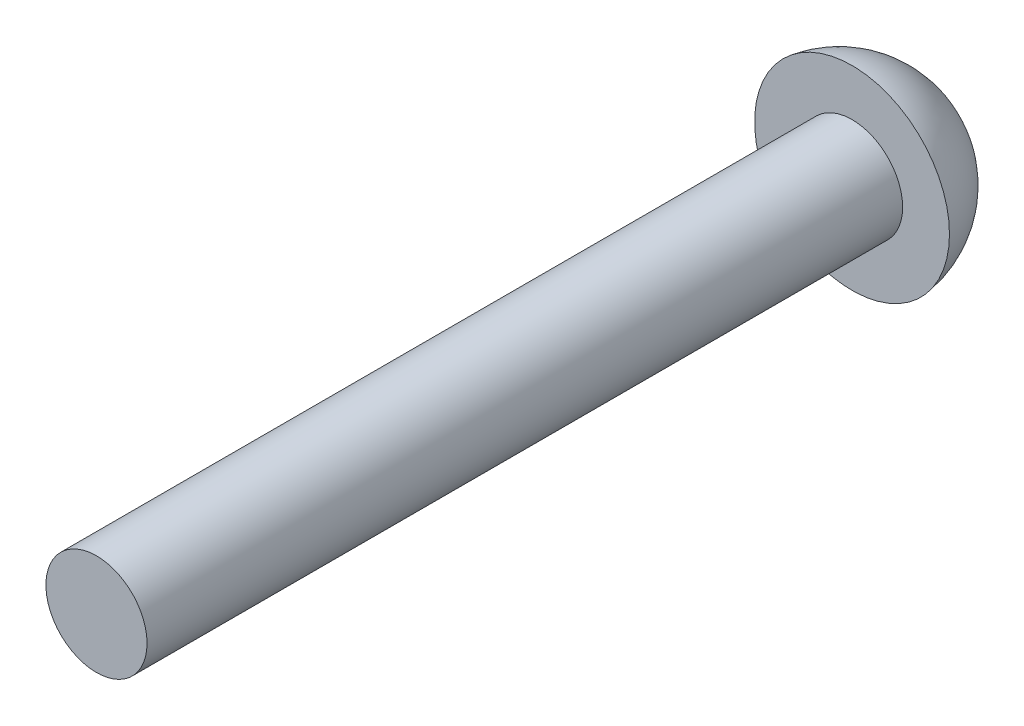
from build123d import *


with BuildPart() as part:
    # Sketch1 → Revolve1 (revolve)
    with BuildSketch(Plane(origin=(0, 0, 0), x_dir=(1, 0, 0), z_dir=(0, 1, 0))):
        with BuildLine():
            Line((0, 0), (0, 28.27))
            ThreePointArc((0, 28.27), (2.177299072, 27.450972809), (3.275, 25.4))
            Line((3.275, 25.4), (1.7, 25.4))
            Line((1.7, 25.4), (1.7, 0))
            Line((1.7, 0), (0, 0))
        make_face()
    revolve(axis=Axis((0, 0, 0), (0, 0, -1)))


solid = part.part
